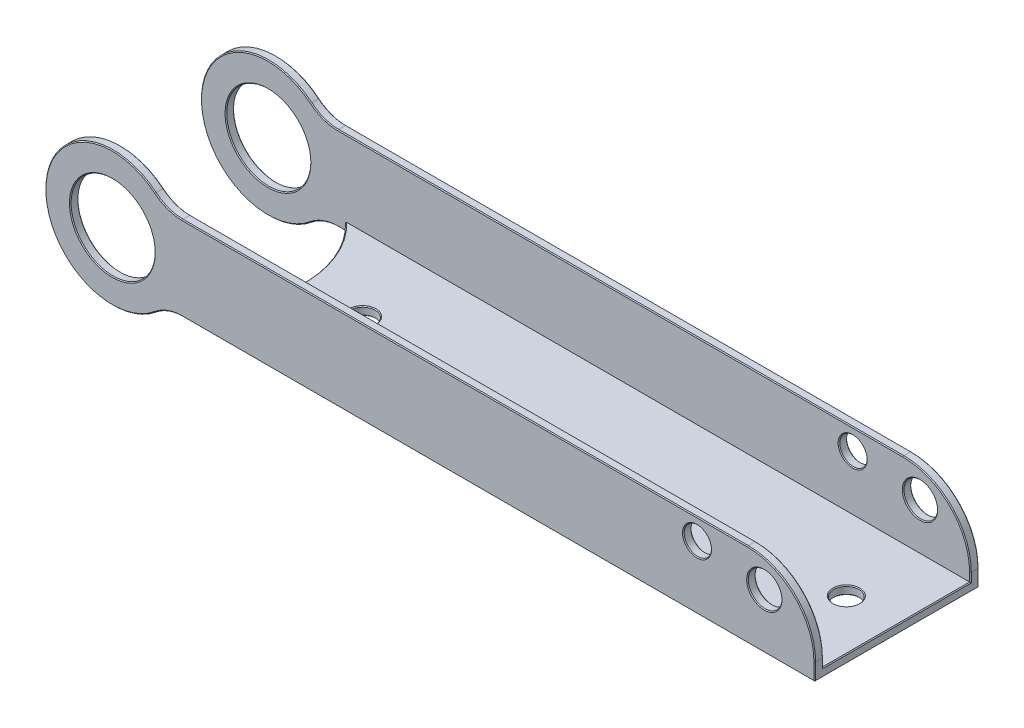
from build123d import *

# Parameters (mm, degrees)
ARMB_W_DEPTH             = 19.5
FILLET_1_R               = 16
FILLET_2_R               = 10
CUT_EXTRUDE_1_DEPTH      = 169.89419765
CUT_EXTRUDE_1_DEPTH_BACK = 169.89419765
SKETCH_2_R               = 10
CUT_EXTRUDE_2_DEPTH      = 169.89419765
CUT_EXTRUDE_2_DEPTH_BACK = 169.89419765
ARMB_T_W                 = 35
ARMB_T_H                 = 18
CUT_EXTRUDE_3_DEPTH      = 169.89419765
SKETCH_5_R               = 4
SKETCH_5_R_2             = 3.25
CUT_EXTRUDE_4_DEPTH      = 173.238207143
SKETCH_6_R               = 3
CUT_EXTRUDE_5_DEPTH      = 171.133036181
CHAMFER_1_SIZE           = 0.2


with BuildPart() as part:
    # ArmB-L → ArmB-W (new, symmetric)
    with BuildSketch(Plane.XY):
        with BuildLine():
            Line((12.489995997, 10), (167, 10))
            Line((167, 10), (167, -10))
            Line((167, -10), (12.489995997, -10))
            ThreePointArc((12.489995997, -10), (-16, 0), (12.489995997, 10))
        make_face()
    extrude(amount=ARMB_W_DEPTH, both=True)

    # ﾌｨﾚｯﾄ1
    fillet_1_edges = [part.edges().sort_by_distance(p)[0] for p in [
        (167, 10, 0),
    ]]
    fillet(fillet_1_edges, radius=FILLET_1_R)

    # ﾌｨﾚｯﾄ2
    fillet_2_edges = [part.edges().sort_by_distance(p)[0] for p in [
        (12.489995997, 10, 0),
        (12.489995997, -10, 0),
    ]]
    fillet(fillet_2_edges, radius=FILLET_2_R)

    # ｽｹｯﾁ2 → ｶｯﾄ - 押し出し1 (cut, two sides: drawn at the far end of the back side and taken through both)
    with BuildSketch(Plane.XY.offset(-CUT_EXTRUDE_1_DEPTH_BACK)):
        Circle(SKETCH_2_R)
    extrude(amount=CUT_EXTRUDE_1_DEPTH + CUT_EXTRUDE_1_DEPTH_BACK, mode=Mode.SUBTRACT)

    # ｽｹｯﾁ3 → ｶｯﾄ - 押し出し2 (cut, two sides: drawn at the far end of the back side and taken through both)
    with BuildSketch(Plane(origin=(0, 0, 0), x_dir=(1, 0, 0), z_dir=(0, 1, 0)).offset(-CUT_EXTRUDE_2_DEPTH_BACK)):
        with BuildLine():
            Line((-16, 17.5), (18.424067706, 17.5))
            ThreePointArc((18.424067706, 17.5), (26, 0), (18.424067706, -17.5))
            Line((18.424067706, -17.5), (-16, -17.5))
            Line((-16, -17.5), (-16, 17.5))
        make_face()
    extrude(amount=CUT_EXTRUDE_2_DEPTH + CUT_EXTRUDE_2_DEPTH_BACK, mode=Mode.SUBTRACT)

    # ArmB-t → ｶｯﾄ - 押し出し3 (cut, through all)
    with BuildSketch(Plane(origin=(0, 0, 0), x_dir=(0, 0, -1), z_dir=(1, 0, 0))):
        with Locations((0, 1)):
            Rectangle(ARMB_T_W, ARMB_T_H)
    extrude(amount=CUT_EXTRUDE_3_DEPTH, mode=Mode.SUBTRACT)

    # ｽｹｯﾁ5 → ｶｯﾄ - 押し出し4 (cut, through all)
    with BuildSketch(Plane.XY.offset(19.5)):
        with Locations((155, 3)):
            Circle(SKETCH_5_R)
        with Locations((139, 5)):
            Circle(SKETCH_5_R_2)
    extrude(amount=-CUT_EXTRUDE_4_DEPTH, mode=Mode.SUBTRACT)

    # ｽｹｯﾁ6 → ｶｯﾄ - 押し出し5 (cut, through all)
    with BuildSketch(Plane.XZ.offset(10)):
        with Locations(Location((155, 0, 0), (0, 0, 270))):
            Circle(SKETCH_6_R)
        with Locations(Location((40, 0, 0), (0, 0, 270))):
            Circle(SKETCH_6_R)
    extrude(amount=-CUT_EXTRUDE_5_DEPTH, mode=Mode.SUBTRACT)

    # 面取り1
    chamfer_1_edges = [part.edges().sort_by_distance(p)[0] for p in [
        (167, -8, 19.5),
        (151, 3, -19.5),
        (151, 3, -17.5),
        (151, 3, 17.5),
        (151, 3, 19.5),
        (135.75, 5, -19.5),
        (135.75, 5, -17.5),
        (135.75, 5, 17.5),
        (135.75, 5, 19.5),
        (155, -8, 3),
        (155, -10, 3),
        (40, -8, 3),
        (40, -10, 3),
        (83.806623863, 10, -19.5),
        (83.806623863, 10, 19.5),
        (162.313708499, 5.313708499, -19.5),
        (162.313708499, 5.313708499, 19.5),
        (91.806623863, -10, -19.5),
        (91.806623863, -10, 19.5),
        (-16, 0, -19.5),
        (-16, 0, 19.5),
        (13.216416623, -10.594600569, -19.5),
        (13.216416623, -10.594600569, 19.5),
        (13.216416623, 10.594600569, -19.5),
        (13.216416623, 10.594600569, 19.5),
        (-10, 0, -19.5),
        (-10, 0, 19.5),
        (167, -8, -19.5),
        (26, -10, 0),
        (-10, 0, -17.5),
        (17.518657716, -10, -17.5),
        (13.216416623, -10.594600569, -17.5),
        (-16, 0, -17.5),
        (13.216416623, 10.594600569, -17.5),
        (83.806623863, 10, -17.5),
        (-10, 0, 17.5),
        (13.216416623, -10.594600569, 17.5),
        (17.518657716, -10, 17.5),
        (83.806623863, 10, 17.5),
        (13.216416623, 10.594600569, 17.5),
        (-16, 0, 17.5),
        (167, -10, 0),
        (162.313708499, 5.313708499, 17.5),
        (162.313708499, 5.313708499, -17.5),
        (26, -8, 0),
        (167, -7, -17.5),
        (167, -7, 17.5),
        (167, -8, 0),
    ]]
    chamfer(chamfer_1_edges, length=CHAMFER_1_SIZE)


solid = part.part
